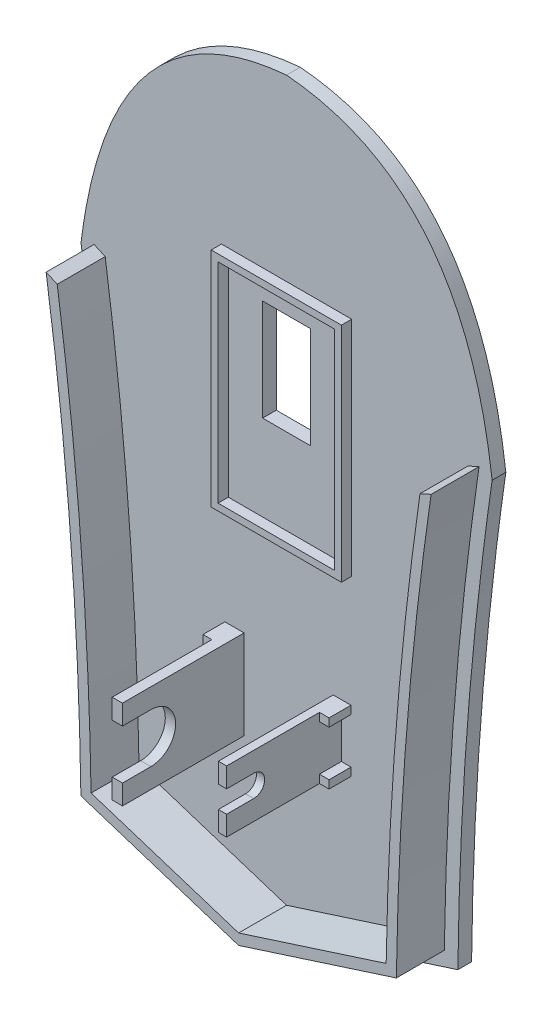
from build123d import *

# Parameters (mm, degrees)
P_IDAT_VYSUNUT_M3_DEPTH  = 2
SKICA5_W                 = 19
SKICA5_H                 = 32.5
P_IDAT_VYSUNUT_M4_DEPTH  = 1.5
SKICA6_W                 = 1.5
SKICA6_H                 = 13
P_IDAT_VYSUNUT_M5_DEPTH  = 17.75
SKICA6_4_W               = 1.2
SKICA6_4_H               = 9
P_IDAT_VYSUNUT_M6_DEPTH  = 16.75
SKICA9_W                 = 1.3
SKICA9_H                 = 1.369535349
SKICA9_H_2               = 1.34
P_IDAT_VYSUNUT_M7_DEPTH  = 3.2
ODEBRAT_VYSUNUT_M5_DEPTH = 1.2
ODEBRAT_VYSUNUT_M6_DEPTH = 1.5
SKICA13_W                = 7
SKICA13_H                = 14.8
ODEBRAT_VYSUNUT_M7_DEPTH = 2
P_IDAT_VYSUNUT_M9_DEPTH  = 7


with BuildPart() as part:
    # Skica3 → Přidat vysunutím3 (new body)
    with BuildSketch(Plane.XY):
        with BuildLine():
            Line((0, 0), (25, 8.027622297))
            add(Edge.make_bspline(
                [(25, 8.027622297), (25.362983363, 40.405597735), (30, 72.39878495)],
                knots=[0, 0, 0, 1, 1, 1], degree=2))
            add(Edge.make_bspline(
                [(30, 72.39878495), (25.810182082, 106.393156288), (0, 108.597151184)],
                knots=[0, 0, 0, 1, 1, 1], degree=2))
            add(Edge.make_bspline(
                [(-30, 72.39878495), (-25.810182082, 106.393156288), (0, 108.597151184)],
                knots=[0, 0, 0, 1, 1, 1], degree=2))
            add(Edge.make_bspline(
                [(-25, 8.027622297), (-25.362983363, 40.405597735), (-30, 72.39878495)],
                knots=[0, 0, 0, 1, 1, 1], degree=2))
            Line((-25, 8.027622297), (0, 0))
        make_face()
    extrude(amount=P_IDAT_VYSUNUT_M3_DEPTH)

    # Skica5 → Přidat vysunutím4 (add)
    with BuildSketch(Plane.XY.offset(2)):
        with Locations((0, 66.25)):
            Rectangle(SKICA5_W, SKICA5_H)
        Polygon((-8.5, 81.5), (8.5, 81.5), (8.5, 51), (0, 51), (-8.5, 51), align=None, mode=Mode.SUBTRACT)
    extrude(amount=P_IDAT_VYSUNUT_M4_DEPTH)

    # Skica6 → Přidat vysunutím5 (add)
    with BuildSketch(Plane.XY.offset(2)):
        with Locations((-6.95, 28.5)):
            Rectangle(SKICA6_W, SKICA6_H)
    extrude(amount=P_IDAT_VYSUNUT_M5_DEPTH)

    # Skica6<4> → Přidat vysunutím6 (add)
    with BuildSketch(Plane.XY.offset(2)):
        with Locations((7.4, 29.16)):
            Rectangle(SKICA6_4_W, SKICA6_4_H)
    extrude(amount=P_IDAT_VYSUNUT_M6_DEPTH)

    # Skica9 → Přidat vysunutím7 (add)
    with BuildSketch(Plane.XY.offset(2)):
        Polygon((8, 33.659998668), (8, 32.477114588), (9.4, 32.477114544), (9.4, 33.659998668), align=None)
        Polygon((8, 24.659998668), (8, 25.841591632), (9.399999793, 25.841591589), (9.399999793, 24.659998668), align=None)
        with Locations((-8.35, 22.684767675)):
            Rectangle(SKICA9_W, SKICA9_H)
        with Locations((-8.35, 34.33)):
            Rectangle(SKICA9_W, SKICA9_H_2)
    extrude(amount=P_IDAT_VYSUNUT_M7_DEPTH)

    # Skica11 → Odebrat vysunutím5 (cut)
    with BuildSketch(Plane(origin=(8, 0, 0), x_dir=(0, 0, -1), z_dir=(1, 0, 0))):
        with BuildLine():
            Line((-18.75, 27.56), (-18.75, 30.76))
            Line((-18.75, 30.76), (-14.8, 30.76))
            ThreePointArc((-14.8, 30.76), (-13.2, 29.16), (-14.8, 27.56))
            Line((-14.8, 27.56), (-18.75, 27.56))
        make_face()
    extrude(amount=-ODEBRAT_VYSUNUT_M5_DEPTH, mode=Mode.SUBTRACT)

    # Skica12 → Odebrat vysunutím6 (cut)
    with BuildSketch(Plane.ZY.offset(7.7)):
        with BuildLine():
            Line((19.75, 32.1), (19.75, 24.9))
            Line((19.75, 24.9), (15.6, 24.9))
            ThreePointArc((15.6, 24.9), (12, 28.5), (15.6, 32.1))
            Line((15.6, 32.1), (19.75, 32.1))
        make_face()
    extrude(amount=-ODEBRAT_VYSUNUT_M6_DEPTH, mode=Mode.SUBTRACT)

    # Skica13 → Odebrat vysunutím7 (cut)
    with BuildSketch(Plane.XY.offset(2)):
        with Locations((0, 70.9)):
            Rectangle(SKICA13_W, SKICA13_H)
    extrude(amount=-ODEBRAT_VYSUNUT_M7_DEPTH, mode=Mode.SUBTRACT)

    # Skica15 → Přidat vysunutím9 (add)
    with BuildSketch(Plane.XY.offset(2)):
        with BuildLine():
            Line((-23.017222129, 9.491521925), (0, 2.100579303))
            Line((0, 2.100579303), (23.017222129, 9.491521925))
            add(Edge.make_bspline(
                [(23.017222129, 9.491521925), (23.104228084, 14.820015615), (23.412919749, 25.481851116), (24.427384602, 41.413676681), (25.947336757, 57.30526528), (27.328834525, 67.881140695), (28.08811969, 73.155746738)],
                knots=[-0.017295959, -0.017295959, -0.017295959, -0.017295959, 0.240841414, 0.498978787, 0.75711616, 1.015253532, 1.015253532, 1.015253532, 1.015253532], degree=3))
            Line((28.08811969, 73.155746738), (26.468325097, 72.43096677))
            add(Edge.make_bspline(
                [(21.534974927, 10.590999575), (21.873259628, 31.308522725), (23.516034404, 51.921978771), (26.468325097, 72.43096677)],
                knots=[0, 0, 0, 0, 1, 1, 1, 1], degree=3))
            Line((21.534974927, 10.590999575), (0, 3.676013779))
            Line((0, 3.676013779), (-21.534974927, 10.590999575))
            add(Edge.make_bspline(
                [(-26.468325097, 72.43096677), (-23.516034403, 51.921978771), (-21.873259627, 31.308522725), (-21.534974927, 10.590999575)],
                knots=[0, 0, 0, 0, 1, 1, 1, 1], degree=3))
            Line((-26.468325097, 72.43096677), (-28.08811969, 73.15574674))
            add(Edge.make_bspline(
                [(-28.08811969, 73.15574674), (-27.328834525, 67.881140697), (-25.947336757, 57.305265281), (-24.427384601, 41.413676681), (-23.412919749, 25.481851116), (-23.104228084, 14.820015615), (-23.017222129, 9.491521925)],
                knots=[-0.015253532, -0.015253532, -0.015253532, -0.015253532, 0.24288384, 0.501021213, 0.759158586, 1.017295959, 1.017295959, 1.017295959, 1.017295959], degree=3))
        make_face()
    extrude(amount=P_IDAT_VYSUNUT_M9_DEPTH)


solid = part.part
